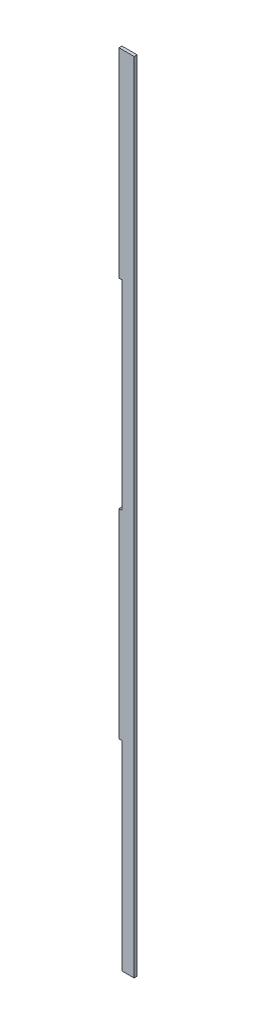
from build123d import *

# Parameters (mm, degrees)
SKETCH1_W           = 8.0875
SKETCH1_H           = 1.5875
BOSS_EXTRUDE1_DEPTH = 427.1518
SKETCH2_W           = 1.5875
SKETCH2_H           = 106.78795
CUT_EXTRUDE1_DEPTH  = 427.1518


with BuildPart() as part:
    # Sketch1 → Boss-Extrude1 (new body)
    with BuildSketch(Plane(origin=(0, 0, 0), x_dir=(1, 0, 0), z_dir=(0, 1, 0))):
        Rectangle(SKETCH1_W, SKETCH1_H)
    extrude(amount=BOSS_EXTRUDE1_DEPTH)

    # Sketch2 → Cut-Extrude1 (cut)
    with BuildSketch(Plane.XY.offset(0.79375)):
        with Locations((-3.25, 53.393975)):
            Rectangle(SKETCH2_W, SKETCH2_H)
        with Locations((-3.25, 266.969875)):
            Rectangle(SKETCH2_W, SKETCH2_H)
    extrude(amount=-CUT_EXTRUDE1_DEPTH, mode=Mode.SUBTRACT)


solid = part.part
